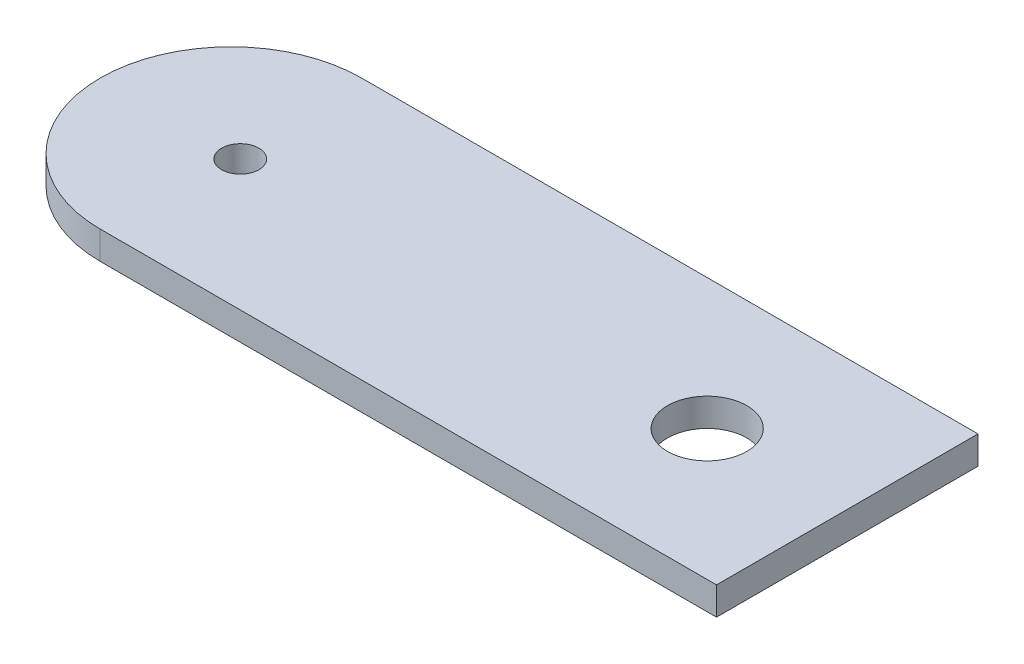
from build123d import *

# Parameters (mm, degrees)
SKETCH_1_W      = 80
SKETCH_1_H      = 28
SKETCH_1_R      = 4.25
SKETCH_1_R_2    = 2
EXTRUDE_1_DEPTH = 3
FILLET_1_RADIUS = 14
FILLET_1_LENGTH = 3


with BuildPart() as part:
    # 草图1 → 凸台-拉伸1 (new body)
    with BuildSketch(Plane(origin=(0, 0, 0), x_dir=(1, 0, 0), z_dir=(0, 1, 0))):
        Rectangle(SKETCH_1_W, SKETCH_1_H)
        with Locations(Location((25, 0, 0), (0, 0, 270))):
            Circle(SKETCH_1_R, mode=Mode.SUBTRACT)
        with Locations(Location((-25, 0, 0), (0, 0, 270))):
            Circle(SKETCH_1_R_2, mode=Mode.SUBTRACT)
    extrude(amount=EXTRUDE_1_DEPTH)

    # 圆角1: full round fillet: the end face becomes a half cylinder, R = half its width
    fillet_1_face = Plane((-40, 1.5, 0), x_dir=(0, 1, 0), z_dir=(-1, 0, 0))  # on the end face: x along it, z out of the body
    fillet_1_slab = fillet_1_face.offset(-FILLET_1_RADIUS / 2) * Box(FILLET_1_LENGTH, 2 * FILLET_1_RADIUS, FILLET_1_RADIUS, mode=Mode.PRIVATE)  # the body's end, R deep
    fillet_1_round = Plane((-26, 1.5, 0), x_dir=(-1, 0, 0), z_dir=(0, 1, 0)) * Cylinder(FILLET_1_RADIUS, FILLET_1_LENGTH, mode=Mode.PRIVATE)  # its axis R under the face
    add(fillet_1_slab - fillet_1_round, mode=Mode.SUBTRACT)


solid = part.part
